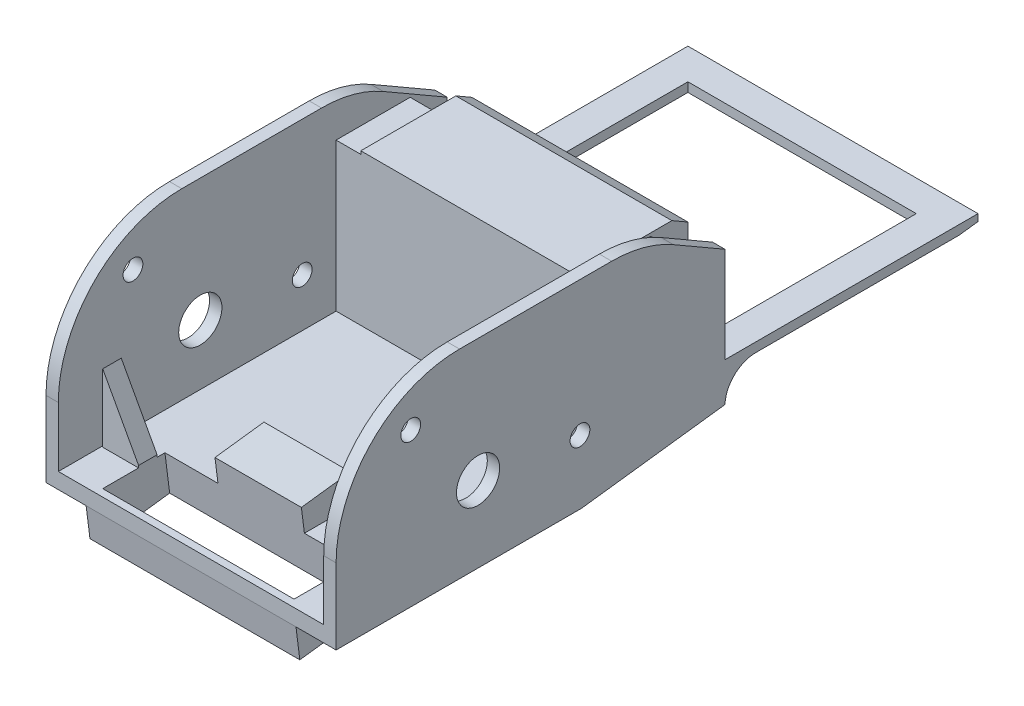
from build123d import *

# Parameters (mm, degrees)
EXTRUDE_1_DEPTH          = 15.5
SKETCH_2_W               = 41
SKETCH_2_H               = 24
EXTRUDE_2_DEPTH          = 2.5
EXTRUDE_3_DEPTH          = 41
EXTRUDE_5_DEPTH          = 1
EXTRUDE_6_DEPTH          = 1
EXTRUDE_7_DEPTH          = 2
CUT_EXTRUDE_1_REACH      = 81.452
SKETCH_10_R              = 1.6
SKETCH_10_R_2            = 3.5
EXTRUDE_8_DEPTH          = 2
CUT_EXTRUDE_2_REACH      = 82.601
SKETCH_12_R              = 3.5
SKETCH_12_R_2            = 1.6
EXTRUDE_9_DEPTH          = 43
EXTRUDE_10_DEPTH         = 3
EXTRUDE_11_DEPTH         = 1.5
FILLET_1_R               = 5
SKETCH_21_W              = 35
SKETCH_21_H              = 18
EXTRUDE_12_DEPTH         = 0.5
CHAMFER_1_SIZE           = 6
CUT_EXTRUDE_4_DEPTH      = 10
CUT_EXTRUDE_4_DEPTH_BACK = 0.7
SKETCH_24_W              = 99.76929375
SKETCH_24_H              = 144.1272379
CHAMFER_2_SIZE           = 15
CHAMFER_2_SIZE2          = 8.660254038
CHAMFER_3_SIZE           = 7.5
CHAMFER_3_SIZE2          = 12.990381057
CHAMFER_4_SIZE           = 1.5
CHAMFER_4_SIZE2          = 2.598076211
EXTRUDE_13_REACH         = 76.53
SKETCH_25_W              = 34
SKETCH_25_H              = 13
CUT_EXTRUDE_5_REACH      = 76.53
SKETCH_26_W              = 31
SKETCH_26_H              = 10
EXTRUDE_14_REACH         = 72.111
SKETCH_27_W              = 14
SKETCH_27_H              = 8
FILLET_2_R               = 20
FILLET_3_R               = 20


with BuildPart() as part:
    # ｽｹｯﾁ1 → ﾎﾞｽ - 押し出し1 (new body)
    with BuildSketch(Plane.XY):
        Polygon((10.055611053, 12.166632755), (-10.143634653, 12.166632755), (-20.595217471, 12.166632755), (-20.595217471, -0.083367245), (-20.595217471, -11.833367245), (-10.143634653, -11.833367245), (10.055611053, -11.833367245), (20.404782529, -11.833367245), (20.404782529, 0.125988678), (20.404782529, 12.166632755), align=None)
        with BuildLine():
            Line((9.95247038, 10.766632755), (-10.04752962, 10.766632755))
            ThreePointArc((-10.04752962, 10.766632755), (-19.245217471, 0.166632755), (-10.04752962, -10.433367245))
            Line((-10.04752962, -10.433367245), (9.95247038, -10.433367245))
            ThreePointArc((9.95247038, -10.433367245), (19.054782529, 0.166632755), (9.95247038, 10.766632755))
        make_face(mode=Mode.SUBTRACT)
    extrude(amount=EXTRUDE_1_DEPTH)

    # ｽｹｯﾁ2 → ﾎﾞｽ - 押し出し2 (add)
    with BuildSketch(Plane.XY.offset(15.5)):
        with Locations((-0.095217471, 0.166632755)):
            Rectangle(SKETCH_2_W, SKETCH_2_H)
    extrude(amount=EXTRUDE_2_DEPTH)

    # ｽｹｯﾁ3 → ﾎﾞｽ - 押し出し3 (add)
    with BuildSketch(Plane.ZY.offset(20.595217471)):
        Polygon((0, -12.15110343), (17.677739562, -14.384321281), (18, -11.833367245), (0, -11.833367245), align=None)
    extrude(amount=-EXTRUDE_3_DEPTH)

    # ｽｹｯﾁ5 → ﾎﾞｽ - 押し出し5 (add)
    with BuildSketch(Plane.ZY.offset(20.595217471)):
        Polygon((0, 12.166632755), (0, -12.15110343), (17.677739562, -14.384321281), (18, -11.833367245), (18, 12.166632755), align=None)
    extrude(amount=EXTRUDE_5_DEPTH)

    # ｽｹｯﾁ7 → ﾎﾞｽ - 押し出し6 (add)
    with BuildSketch(Plane(origin=(20.404782529, 0, 0), x_dir=(0, 0, -1), z_dir=(1, 0, 0))):
        Polygon((0, -12.15110343), (0, 12.166632755), (-18, 12.166632755), (-18, -11.833367245), (-17.677739562, -14.384321281), align=None)
    extrude(amount=EXTRUDE_6_DEPTH)

    # ｽｹｯﾁ8 → ﾎﾞｽ - 押し出し7 (add)
    with BuildSketch(Plane.ZY.offset(21.595217471)):
        Polygon((63, 0.066632755), (63, -14.384321281), (17.677739562, -14.384321281), (0, -12.15110343), (0, 12.166632755), (0, 17.84889657), (48, 17.84889657), (63, 17.84889657), align=None)
    extrude(amount=EXTRUDE_7_DEPTH)

    # ｽｹｯﾁ10 → ｶｯﾄ - 押し出し1 (cut, up to next)
    with BuildSketch(Plane.ZY.offset(23.595217471), mode=Mode.PRIVATE) as cut_extrude_1_sk1:
        with Locations((23.490675042, -4.00656608)):
            Circle(SKETCH_10_R)
    cut_extrude_1_tool1 = extrude(cut_extrude_1_sk1.sketch, amount=-CUT_EXTRUDE_1_REACH, mode=Mode.PRIVATE) & part.part
    # ｽｹｯﾁ10 → ｶｯﾄ - 押し出し1 (cut, up to next)
    with BuildSketch(Plane.ZY.offset(23.595217471), mode=Mode.PRIVATE) as cut_extrude_1_sk2:
        with Locations((50.912685274, 10.451419771)):
            Circle(SKETCH_10_R)
    cut_extrude_1_tool2 = extrude(cut_extrude_1_sk2.sketch, amount=-CUT_EXTRUDE_1_REACH, mode=Mode.PRIVATE) & part.part
    # ｽｹｯﾁ10 → ｶｯﾄ - 押し出し1 (cut, up to next)
    with BuildSketch(Plane.ZY.offset(23.595217471), mode=Mode.PRIVATE) as cut_extrude_1_sk3:
        with Locations((40, -2.085059006)):
            Circle(SKETCH_10_R_2)
    cut_extrude_1_tool3 = extrude(cut_extrude_1_sk3.sketch, amount=-CUT_EXTRUDE_1_REACH, mode=Mode.PRIVATE) & part.part
    add(cut_extrude_1_tool1.solids().sort_by_distance((-23.595217, -4.006566, 23.490675))[0], mode=Mode.SUBTRACT)
    add(cut_extrude_1_tool2.solids().sort_by_distance((-23.595217, 10.45142, 50.912685))[0], mode=Mode.SUBTRACT)
    add(cut_extrude_1_tool3.solids().sort_by_distance((-23.595217, -2.085059, 40))[0], mode=Mode.SUBTRACT)

    # ｽｹｯﾁ11 → ﾎﾞｽ - 押し出し8 (add)
    with BuildSketch(Plane(origin=(21.404782529, 0, 0), x_dir=(0, 0, -1), z_dir=(1, 0, 0))):
        Polygon((-63, -14.384321281), (-17.677739562, -14.384321281), (0, -12.15110343), (0, 17.84889657), (-63, 17.84889657), align=None)
    extrude(amount=EXTRUDE_8_DEPTH)

    # ｽｹｯﾁ12 → ｶｯﾄ - 押し出し2 (cut, up to next)
    with BuildSketch(Plane(origin=(23.404782529, 0, 0), x_dir=(0, 0, -1), z_dir=(1, 0, 0)), mode=Mode.PRIVATE) as cut_extrude_2_sk1:
        with Locations(Location((-40, -2.085059006, 0), (0, 0, 180))):
            Circle(SKETCH_12_R)
    cut_extrude_2_tool1 = extrude(cut_extrude_2_sk1.sketch, amount=-CUT_EXTRUDE_2_REACH, mode=Mode.PRIVATE) & part.part
    # ｽｹｯﾁ12 → ｶｯﾄ - 押し出し2 (cut, up to next)
    with BuildSketch(Plane(origin=(23.404782529, 0, 0), x_dir=(0, 0, -1), z_dir=(1, 0, 0)), mode=Mode.PRIVATE) as cut_extrude_2_sk2:
        with Locations(Location((-50.912685274, 10.451419771, 0), (0, 0, 180))):
            Circle(SKETCH_12_R_2)
    cut_extrude_2_tool2 = extrude(cut_extrude_2_sk2.sketch, amount=-CUT_EXTRUDE_2_REACH, mode=Mode.PRIVATE) & part.part
    # ｽｹｯﾁ12 → ｶｯﾄ - 押し出し2 (cut, up to next)
    with BuildSketch(Plane(origin=(23.404782529, 0, 0), x_dir=(0, 0, -1), z_dir=(1, 0, 0)), mode=Mode.PRIVATE) as cut_extrude_2_sk3:
        with Locations(Location((-23.490675042, -4.00656608, 0), (0, 0, 180))):
            Circle(SKETCH_12_R_2)
    cut_extrude_2_tool3 = extrude(cut_extrude_2_sk3.sketch, amount=-CUT_EXTRUDE_2_REACH, mode=Mode.PRIVATE) & part.part
    add(cut_extrude_2_tool1.solids().sort_by_distance((23.404783, -2.085059, 40))[0], mode=Mode.SUBTRACT)
    add(cut_extrude_2_tool2.solids().sort_by_distance((23.404783, 10.45142, 50.912685))[0], mode=Mode.SUBTRACT)
    add(cut_extrude_2_tool3.solids().sort_by_distance((23.404783, -4.006566, 23.490675))[0], mode=Mode.SUBTRACT)

    # ｽｹｯﾁ13 → ﾎﾞｽ - 押し出し9 (add)
    with BuildSketch(Plane.ZY.offset(-21.404782529)):
        Polygon((17.677739562, -14.384321281), (18, -11.833367245), (63, -11.833367245), (63, -14.384321281), align=None)
    extrude(amount=EXTRUDE_9_DEPTH)

    # ｽｹｯﾁ18 → ﾎﾞｽ - 押し出し10 (add)
    with BuildSketch(Plane.XY.offset(56)):
        Polygon((21.404782529, -0.833367245), (15.404782529, -11.833367245), (21.404782529, -11.833367245), align=None)
    extrude_10 = extrude(amount=-EXTRUDE_10_DEPTH)

    # ﾐﾗｰ2: ﾎﾞｽ - 押し出し10 across plane
    add(extrude_10.mirror(Plane(origin=(0, 0, 0), x_dir=(0, 0, 1), z_dir=(1, 0, 0))))

    # ｽｹｯﾁ20 → ﾎﾞｽ - 押し出し11 (add)
    with BuildSketch(Plane(origin=(0, -5.15110343, 0), x_dir=(1, 0, 0), z_dir=(0, 1, 0))):
        Polygon((23.404782529, 0), (18.404782529, 0), (18.404782529, 5), (18.404782529, 36), (-18.595217471, 36), (-18.595217471, 5), (-18.595217471, 0), (-23.595217471, 0), (-23.595217471, 41), (23.404782529, 41), align=None)
    extrude(amount=-EXTRUDE_11_DEPTH)

    # ﾌｨﾚｯﾄ1
    fillet_1_edges = [part.edges().sort_by_distance(p)[0] for p in [
        (20.904782529, -6.65110343, 0),
        (-21.095217471, -6.65110343, 0),
    ]]
    fillet(fillet_1_edges, radius=FILLET_1_R)

    # ｽｹｯﾁ21 → ﾎﾞｽ - 押し出し12 (add)
    with BuildSketch(Plane(origin=(0, 12.166632755, 0), x_dir=(1, 0, 0), z_dir=(0, 1, 0))):
        with Locations((-0.095217471, -9)):
            Rectangle(SKETCH_21_W, SKETCH_21_H)
    extrude(amount=EXTRUDE_12_DEPTH)

    # 面取り1
    chamfer_1_edges = [part.edges().sort_by_distance(p)[0] for p in [
        (19.404782529, 12.166632755, 0),
        (-19.595217471, 12.166632755, 0),
    ]]
    chamfer(chamfer_1_edges, length=CHAMFER_1_SIZE)

    # ｽｹｯﾁ24 → ｶｯﾄ - 押し出し4 (cut, two sides: drawn at the far end of the back side and taken through both)
    with BuildSketch(Plane(origin=(0, -11.960228801, -1.51092827), x_dir=(1, 0, 0), z_dir=(0, -0.9921147013144787, -0.12533323356429749)).offset(-CUT_EXTRUDE_4_DEPTH_BACK)):
        with Locations((0, 9.634165713)):
            Rectangle(SKETCH_24_W, SKETCH_24_H)
    extrude(amount=CUT_EXTRUDE_4_DEPTH + CUT_EXTRUDE_4_DEPTH_BACK, mode=Mode.SUBTRACT)

    # 面取り2
    chamfer_2_edges = [part.edges().sort_by_distance(p)[0] for p in [
        (-22.595217471, 17.84889657, 0),
    ]]
    chamfer_2_side = [part.faces().sort_by_distance(p)[0] for p in [
        (-22.595217471, 17.84889657, 31.5),
    ]]
    chamfer(chamfer_2_edges, length=CHAMFER_2_SIZE, length2=CHAMFER_2_SIZE2, reference=chamfer_2_side[0])

    # 面取り3
    chamfer_3_edges = [part.edges().sort_by_distance(p)[0] for p in [
        (22.404782529, 17.84889657, 0),
    ]]
    chamfer_3_side = [part.faces().sort_by_distance(p)[0] for p in [
        (-23.041397644, 2.018769551, 0),
    ]]
    chamfer(chamfer_3_edges, length=CHAMFER_3_SIZE, length2=CHAMFER_3_SIZE2, reference=chamfer_3_side[0])

    # 面取り4
    chamfer_4_edges = [part.edges().sort_by_distance(p)[0] for p in [
        (-0.095217471, 12.666632755, 0),
    ]]
    chamfer_4_side = [part.faces().sort_by_distance(p)[0] for p in [
        (22.876540457, 2.59889657, 0),
    ]]
    chamfer(chamfer_4_edges, length=CHAMFER_4_SIZE, length2=CHAMFER_4_SIZE2, reference=chamfer_4_side[0])

    # ｽｹｯﾁ25 → ﾎﾞｽ - 押し出し13 (add, up to next)
    with BuildSketch(Plane(origin=(0, -11.26574851, -1.423195007), x_dir=(1, 0, 0), z_dir=(0, -0.9921147013144788, -0.12533323356429746)), mode=Mode.PRIVATE) as extrude_13_sk1:
        with Locations((-0.095217471, 57.806059682)):
            Rectangle(SKETCH_25_W, SKETCH_25_H)
    extrude_13_tool1 = extrude(extrude_13_sk1.sketch, amount=-EXTRUDE_13_REACH, mode=Mode.PRIVATE) - part.part
    add(extrude_13_tool1.solids().sort_by_distance((-0.095217, -18.510769, 55.927047))[0])

    # ｽｹｯﾁ26 → ｶｯﾄ - 押し出し5 (cut, up to next)
    with BuildSketch(Plane(origin=(0, -11.26574851, -1.423195007), x_dir=(1, 0, 0), z_dir=(0, -0.9921147013144788, -0.1253332335642974)), mode=Mode.PRIVATE) as cut_extrude_5_sk1:
        with Locations((-0.095217471, 57.806059682)):
            Rectangle(SKETCH_26_W, SKETCH_26_H)
    cut_extrude_5_tool1 = extrude(cut_extrude_5_sk1.sketch, amount=-CUT_EXTRUDE_5_REACH, mode=Mode.PRIVATE) & part.part
    add(cut_extrude_5_tool1.solids().sort_by_distance((-0.095217, -18.510769, 55.927047))[0], mode=Mode.SUBTRACT)

    # ﾎﾞｽ - 押し出し14: up to this plane
    extrude_14_end = Plane(origin=(-66.989211101, -11.833367245, 18), z_dir=(0, -1, 0))
    # ｽｹｯﾁ27 → ﾎﾞｽ - 押し出し14 (add, up to the surface)
    with BuildSketch(Plane(origin=(0, -1.344601497, -0.169862671), x_dir=(-1, 0, 0), z_dir=(0, -0.9921147013144788, -0.1253332335642974)), mode=Mode.PRIVATE) as extrude_14_sk1:
        with Locations((0, -48.806059682)):
            Rectangle(SKETCH_27_W, SKETCH_27_H)
    extrude_14_tool1 = split(extrude(extrude_14_sk1.sketch, amount=EXTRUDE_14_REACH, mode=Mode.PRIVATE), bisect_by=extrude_14_end, keep=Keep.BOTH, mode=Mode.PRIVATE)
    add(extrude_14_tool1.solids().sort_by_distance((0, -7.461623, 48.251347))[0])

    # ﾌｨﾚｯﾄ2
    fillet_2_edges = [part.edges().sort_by_distance(p)[0] for p in [
        (-22.595217471, 17.84889657, 63),
        (22.404782529, 17.84889657, 63),
    ]]
    fillet(fillet_2_edges, radius=FILLET_2_R)

    # ﾌｨﾚｯﾄ3
    fillet_3_edges = [part.edges().sort_by_distance(p)[0] for p in [
        (-22.595217471, 17.84889657, 15),
        (22.404782529, 17.84889657, 12.990381057),
    ]]
    fillet(fillet_3_edges, radius=FILLET_3_R)


solid = part.part
